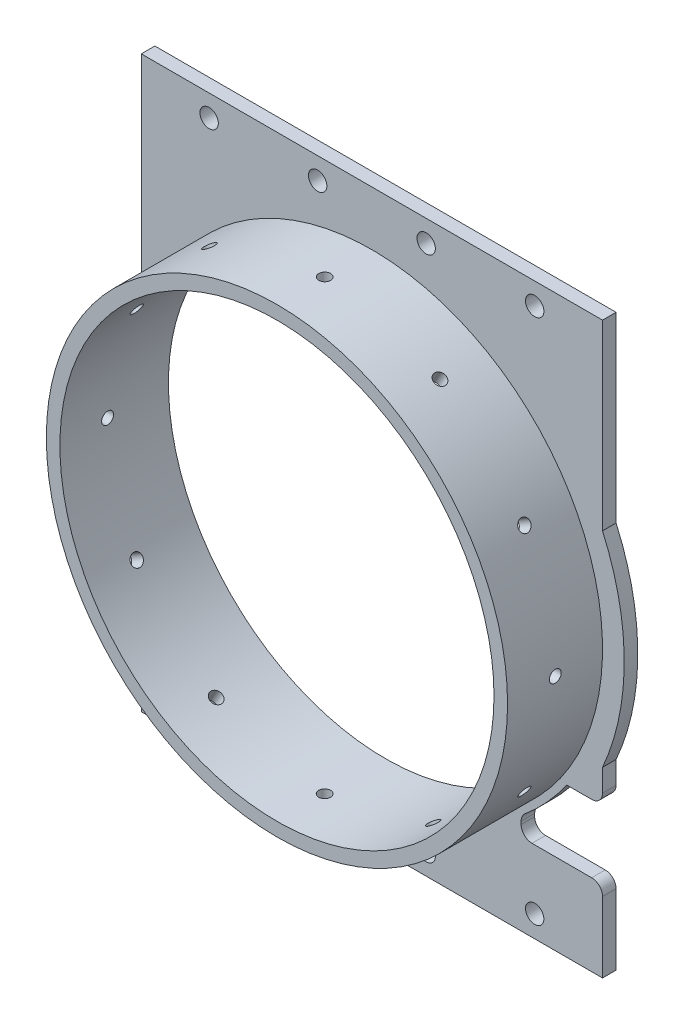
from build123d import *

# Parameters (mm, degrees)
SKETCH1_R             = 53.975
SKETCH1_R_2           = 50.8
BOSS_EXTRUDE1_DEPTH   = 25.4
SKETCH2_R             = 50.8
BOSS_EXTRUDE2_DEPTH   = 3.175
CUT_EXTRUDE1_DEPTH    = 89.61606443
BOSS_EXTRUDE3_DEPTH   = 3.175
FILLET1_R             = 2.54
SKETCH5_R             = 1.397
CUT_EXTRUDE2_DEPTH    = 93.618619348
CIRPATTERN1_COUNT     = 7
CIRPATTERN1_ANGLE     = 180
F_6_CLEARANCE_HOLE1_D = 4.3053


with BuildPart() as part:
    # Sketch1 → Boss-Extrude1 (new body)
    with BuildSketch(Plane.XY):
        Circle(SKETCH1_R)
        Circle(SKETCH1_R_2, mode=Mode.SUBTRACT)
    extrude(amount=BOSS_EXTRUDE1_DEPTH)

    # Sketch2 → Boss-Extrude2 (add)
    with BuildSketch(Plane.XY):
        Polygon((-53.975, 0), (-53.975, 66.675), (53.975, 66.675), (53.975, 0), (53.975, -66.675), (-53.975, -66.675), align=None)
        Circle(SKETCH2_R, mode=Mode.SUBTRACT)
    extrude(amount=BOSS_EXTRUDE2_DEPTH)

    # Sketch3 → Cut-Extrude1 (cut, through all)
    with BuildSketch(Plane.XY.offset(3.175)):
        with BuildLine():
            Line((53.975, -47.625), (34.925, -47.625))
            Line((34.925, -47.625), (34.925, -43.213837844))
            ThreePointArc((34.925, -43.213837844), (40.667207643, -37.859868314), (45.597466007, -31.75))
            Line((45.597466007, -31.75), (53.975, -31.75))
            Line((53.975, -31.75), (53.975, -47.625))
        make_face()
    extrude(amount=-CUT_EXTRUDE1_DEPTH, mode=Mode.SUBTRACT)

    # Sketch4 → Boss-Extrude3 (add)
    with BuildSketch(Plane.XY.offset(3.175)):
        with BuildLine():
            Line((53.975, 23.962312075), (53.975, -23.962312075))
            ThreePointArc((53.975, -23.962312075), (59.055, 0), (53.975, 23.962312075))
        make_face()
    extrude(amount=-BOSS_EXTRUDE3_DEPTH)

    # Fillet1
    fillet1_edges = [part.edges().sort_by_distance(p)[0] for p in [
        (53.975, -31.75, 1.5875),
        (53.975, -47.625, 1.5875),
        (34.925, -47.625, 1.5875),
        (34.925, -43.213837844, 1.5875),
    ]]
    fillet(fillet1_edges, radius=FILLET1_R)

    # Sketch5 → Cut-Extrude2 (cut, symmetric)
    with BuildSketch(Plane(origin=(0, 0, 0), x_dir=(1, 0, 0), z_dir=(0, 1, 0))):
        with Locations(Location((0, -14.229591777, 0), (0, 0, 270))):
            Circle(SKETCH5_R)
    cut_extrude2 = extrude(amount=CUT_EXTRUDE2_DEPTH, both=True, mode=Mode.SUBTRACT)

    # CirPattern1: Cut-Extrude2 ×7 about axis
    cirpattern1_axis = Axis((0, 0, 25.4), (0, 0, 1))
    for i in range(1, CIRPATTERN1_COUNT):
        add(cut_extrude2.rotate(cirpattern1_axis, i * CIRPATTERN1_ANGLE / (CIRPATTERN1_COUNT - 1)), mode=Mode.SUBTRACT)

    # #6 Clearance Hole1 (through all)
    with Locations(Plane.XY.offset(3.175)):
        with Locations((-38.1, 61.595), (-12.7, 61.595), (12.7, 61.595), (38.1, 61.595), (38.1, -61.595), (12.7, -61.595), (-12.7, -61.595), (-38.1, -61.595)):
            Hole(F_6_CLEARANCE_HOLE1_D / 2)


solid = part.part
